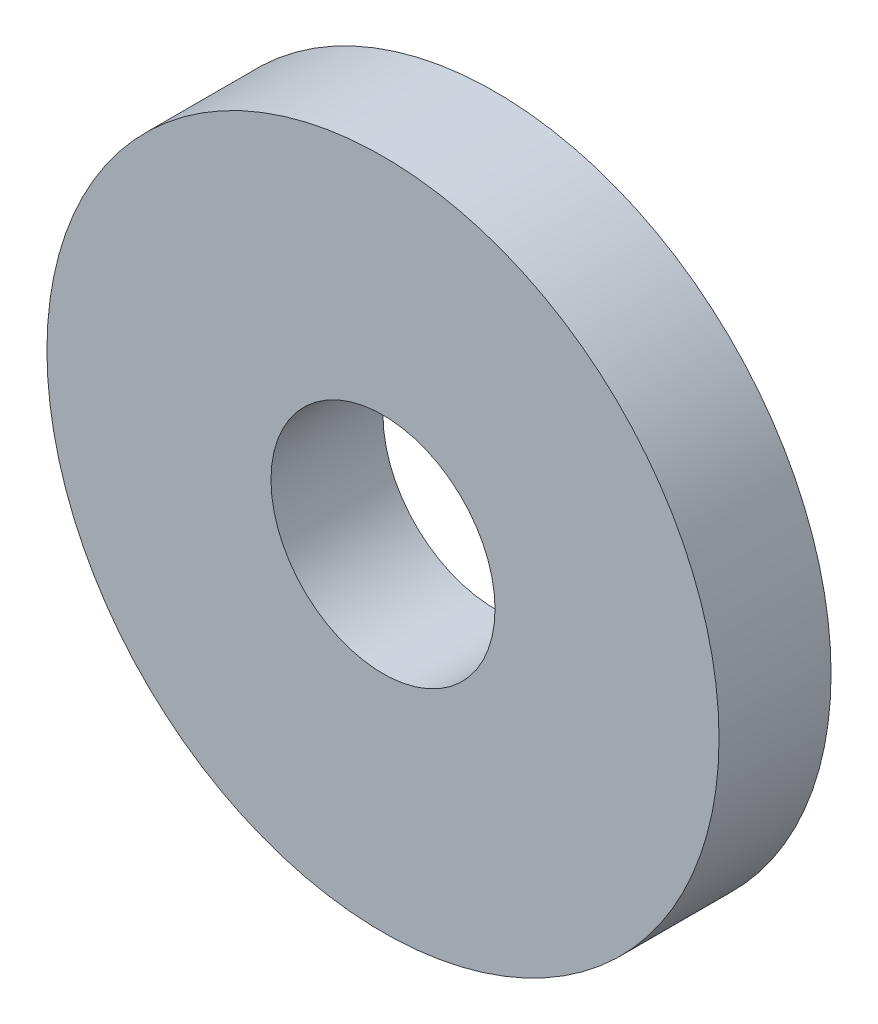
from build123d import *

# Parameters (mm, degrees)
SKETCH_1_R      = 9
SKETCH_1_R_2    = 3
EXTRUDE_2_DEPTH = 3


with BuildPart() as part:
    # Эскиз1 → Вытянуть2 (new body)
    with BuildSketch(Plane.XY):
        Circle(SKETCH_1_R)
        Circle(SKETCH_1_R_2, mode=Mode.SUBTRACT)
    extrude(amount=EXTRUDE_2_DEPTH)


solid = part.part
